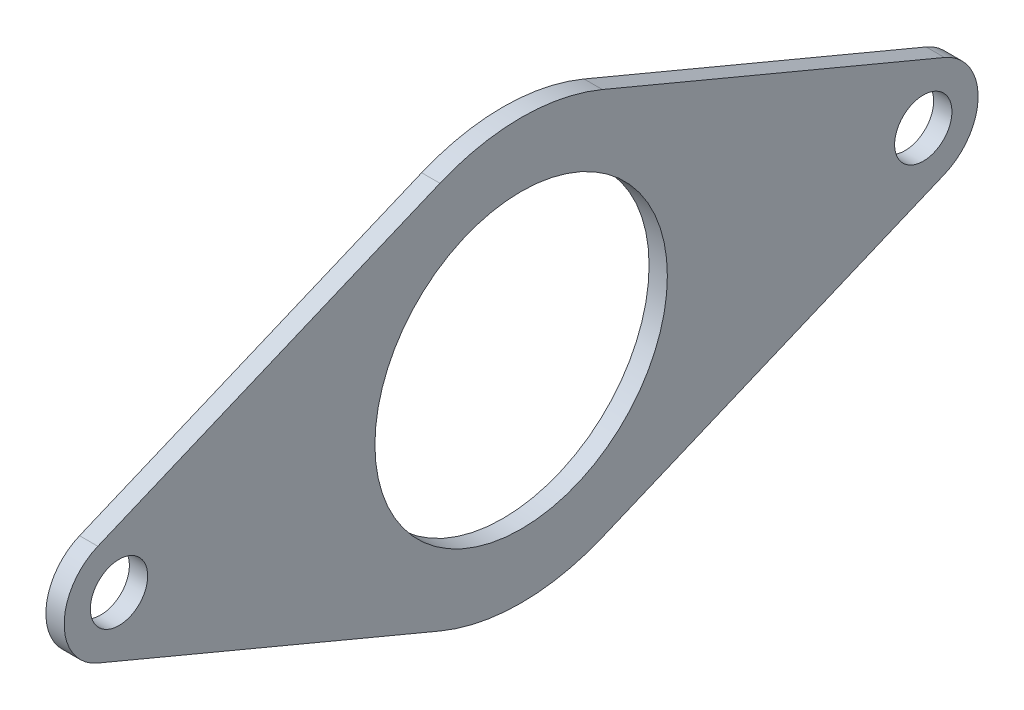
from build123d import *

# Parameters (mm, degrees)
SKETCH1_R           = 12.7
SKETCH1_R_2         = 2.4892
BOSS_EXTRUDE1_DEPTH = 0.79375


with BuildPart() as part:
    # Sketch1 → Boss-Extrude1 (new, symmetric)
    with BuildSketch(Plane(origin=(0, 0, 0), x_dir=(0, 0, -1), z_dir=(1, 0, 0))):
        with BuildLine():
            Line((-36.765056818, -4.392675398), (-7.053551136, -16.838589027))
            ThreePointArc((-7.053551136, -16.838589027), (0, -18.25625), (7.053551136, -16.838589027))
            Line((7.053551136, -16.838589027), (36.765056818, -4.392675398))
            ThreePointArc((36.765056818, -4.392675398), (39.6875, 0), (36.765056818, 4.392675398))
            Line((36.765056818, 4.392675398), (7.053551136, 16.838589027))
            ThreePointArc((7.053551136, 16.838589027), (0, 18.25625), (-7.053551136, 16.838589027))
            Line((-7.053551136, 16.838589027), (-36.765056818, 4.392675398))
            ThreePointArc((-36.765056818, 4.392675398), (-39.6875, 0), (-36.765056818, -4.392675398))
        make_face()
        Circle(SKETCH1_R, mode=Mode.SUBTRACT)
        with Locations((34.925, 0)):
            Circle(SKETCH1_R_2, mode=Mode.SUBTRACT)
        with Locations((-34.925, 0)):
            Circle(SKETCH1_R_2, mode=Mode.SUBTRACT)
    extrude(amount=BOSS_EXTRUDE1_DEPTH, both=True)


solid = part.part
